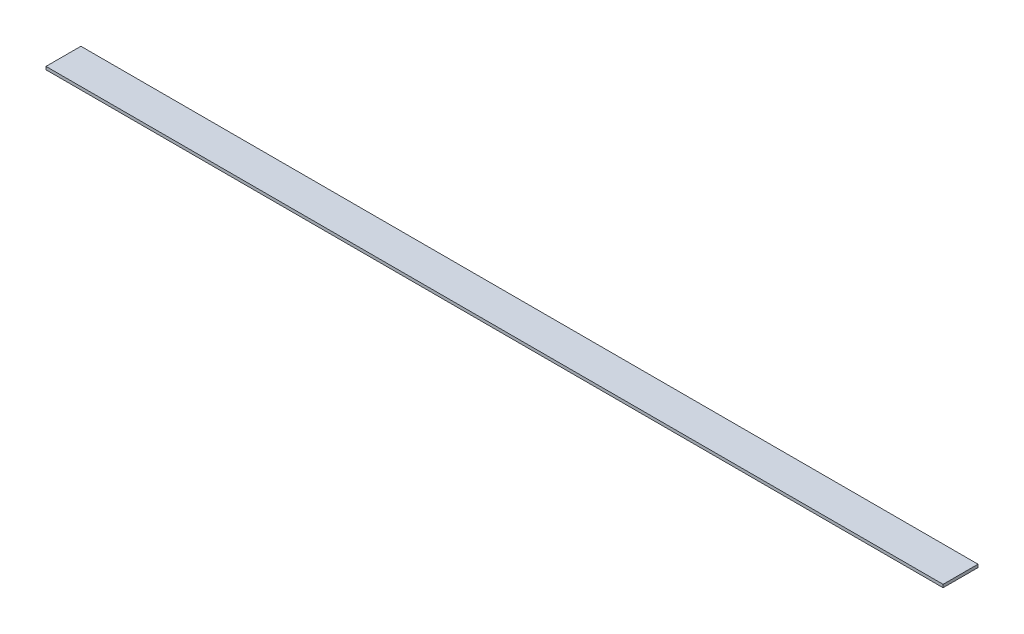
from build123d import *

# Parameters (mm, degrees)
SKETCH1_W           = 900
SKETCH1_H           = 35
BOSS_EXTRUDE1_DEPTH = 1.5


with BuildPart() as part:
    # Sketch1 → Boss-Extrude1 (new, symmetric)
    with BuildSketch(Plane(origin=(0, 0, 0), x_dir=(1, 0, 0), z_dir=(0, 1, 0))):
        Rectangle(SKETCH1_W, SKETCH1_H)
    extrude(amount=BOSS_EXTRUDE1_DEPTH, both=True)


solid = part.part
